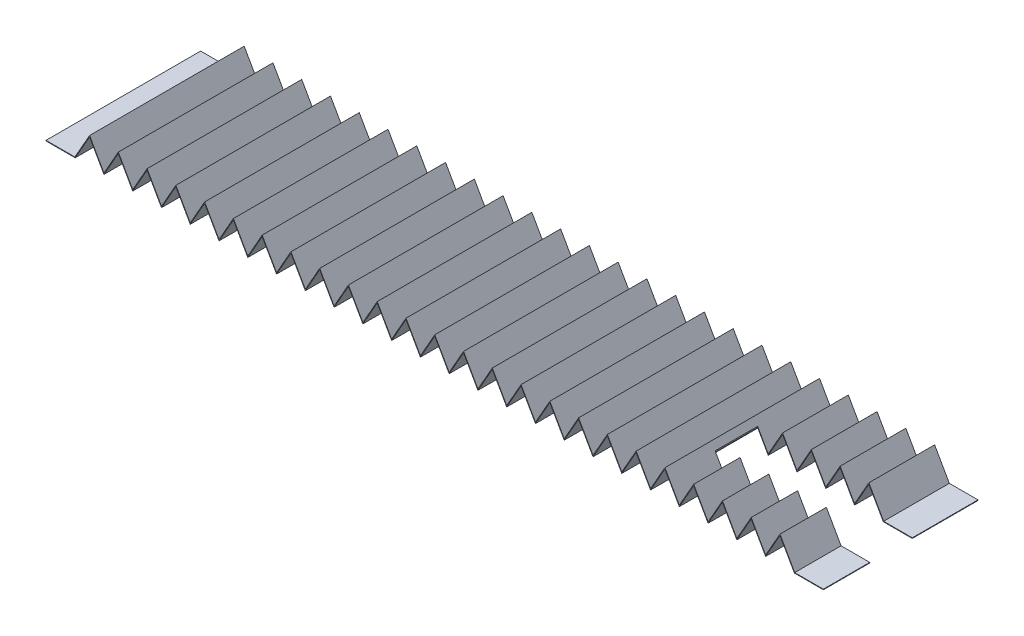
from build123d import *

# Parameters (mm, degrees)
EXTRUDE_THIN1_DEPTH     = 40
CUT_EXTRUDE4_DEPTH      = 390.389022579
CUT_EXTRUDE4_DEPTH_BACK = 390.389022579
SKETCH2_W               = 80
SKETCH2_H               = 22


with BuildPart() as part:
    # Sketch1 → Extrude-Thin1 (new, symmetric)
    with BuildSketch(Plane.XY):
        Polygon((-15.1, 0), (0, 0), (7.44170041, 13.13891529), (14.88340082, 0), (22.325101231, 13.13891529), (29.766801641, 0), (37.208502051, 13.13891529), (44.650202461, 0), (52.091902871, 13.13891529), (59.533603282, 0), (66.975303692, 13.13891529), (74.417004102, 0), (81.858704512, 13.13891529), (89.300404922, 0), (96.742105333, 13.13891529), (104.183805743, 0), (111.625506153, 13.13891529), (119.067206563, 0), (126.508906973, 13.13891529), (133.950607384, 0), (141.392307794, 13.13891529), (148.834008204, 0), (156.275708614, 13.13891529), (163.717409024, 0), (171.159109435, 13.13891529), (178.600809845, 0), (186.042510255, 13.13891529), (193.484210665, 0), (200.925911075, 13.13891529), (208.367611485, 0), (215.809311896, 13.13891529), (223.251012306, 0), (230.692712716, 13.13891529), (238.134413126, 0), (245.576113536, 13.13891529), (253.017813947, 0), (260.459514357, 13.13891529), (267.901214767, 0), (275.342915177, 13.13891529), (282.784615587, 0), (290.226315998, 13.13891529), (297.668016408, 0), (305.109716818, 13.13891529), (312.551417228, 0), (319.993117638, 13.13891529), (327.434818049, 0), (334.876518459, 13.13891529), (342.318218869, 0), (349.759919279, 13.13891529), (357.201619689, 0), (364.6433201, 13.13891529), (372.08502051, 0), (387.08502051, 0), (387.08502051, 0.3), (372.259881967, 0.3), (364.6433201, 13.747647132), (357.201619689, 0.608731842), (349.759919279, 13.747647132), (342.318218869, 0.608731842), (334.876518459, 13.747647132), (327.434818049, 0.608731842), (319.993117638, 13.747647132), (312.551417228, 0.608731842), (305.109716818, 13.747647132), (297.668016408, 0.608731842), (290.226315998, 13.747647132), (282.784615587, 0.608731842), (275.342915177, 13.747647132), (267.901214767, 0.608731842), (260.459514357, 13.747647132), (253.017813947, 0.608731842), (245.576113536, 13.747647132), (238.134413126, 0.608731842), (230.692712716, 13.747647132), (223.251012306, 0.608731842), (215.809311896, 13.747647132), (208.367611485, 0.608731842), (200.925911075, 13.747647132), (193.484210665, 0.608731842), (186.042510255, 13.747647132), (178.600809845, 0.608731842), (171.159109435, 13.747647132), (163.717409024, 0.608731842), (156.275708614, 13.747647132), (148.834008204, 0.608731842), (141.392307794, 13.747647132), (133.950607384, 0.608731842), (126.508906973, 13.747647132), (119.067206563, 0.608731842), (111.625506153, 13.747647132), (104.183805743, 0.608731842), (96.742105333, 13.747647132), (89.300404922, 0.608731842), (81.858704512, 13.747647132), (74.417004102, 0.608731842), (66.975303692, 13.747647132), (59.533603282, 0.608731842), (52.091902871, 13.747647132), (44.650202461, 0.608731842), (37.208502051, 13.747647132), (29.766801641, 0.608731842), (22.325101231, 13.747647132), (14.88340082, 0.608731842), (7.44170041, 13.747647132), (-0.174861457, 0.3), (-15.1, 0.3), align=None)
    extrude(amount=EXTRUDE_THIN1_DEPTH, both=True)

    # Sketch2 → Cut-Extrude4 (cut, two sides: drawn at the far end of the back side and taken through both)
    with BuildSketch(Plane(origin=(0, 0, 0), x_dir=(1, 0, 0), z_dir=(0, 1, 0)).offset(-CUT_EXTRUDE4_DEPTH_BACK)):
        with Locations((347.08502051, -5)):
            Rectangle(SKETCH2_W, SKETCH2_H)
    extrude(amount=CUT_EXTRUDE4_DEPTH + CUT_EXTRUDE4_DEPTH_BACK, mode=Mode.SUBTRACT)


solid = part.part
